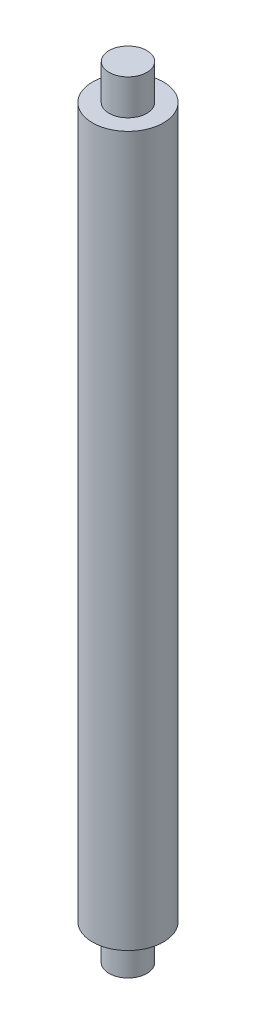
from build123d import *

# Parameters (mm, degrees)
SKETCH1_R           = 1.6
BOSS_EXTRUDE1_DEPTH = 3
SKETCH2_R           = 3
BOSS_EXTRUDE2_DEPTH = 60
SKETCH3_R           = 1.6
BOSS_EXTRUDE3_DEPTH = 3


with BuildPart() as part:
    # Sketch1 → Boss-Extrude1 (new body)
    with BuildSketch(Plane(origin=(0, 0, 0), x_dir=(1, 0, 0), z_dir=(0, 1, 0))):
        with Locations(Location((0, 0, 0), (0, 0, 270))):
            Circle(SKETCH1_R)
    extrude(amount=BOSS_EXTRUDE1_DEPTH)

    # Sketch2 → Boss-Extrude2 (add)
    with BuildSketch(Plane(origin=(0, 3, 0), x_dir=(1, 0, 0), z_dir=(0, 1, 0))):
        with Locations(Location((0, 0, 0), (0, 0, 270))):
            Circle(SKETCH2_R)
    extrude(amount=BOSS_EXTRUDE2_DEPTH)

    # Sketch3 → Boss-Extrude3 (add)
    with BuildSketch(Plane(origin=(0, 63, 0), x_dir=(1, 0, 0), z_dir=(0, 1, 0))):
        with Locations(Location((0, 0, 0), (0, 0, 270))):
            Circle(SKETCH3_R)
    extrude(amount=BOSS_EXTRUDE3_DEPTH)


solid = part.part
